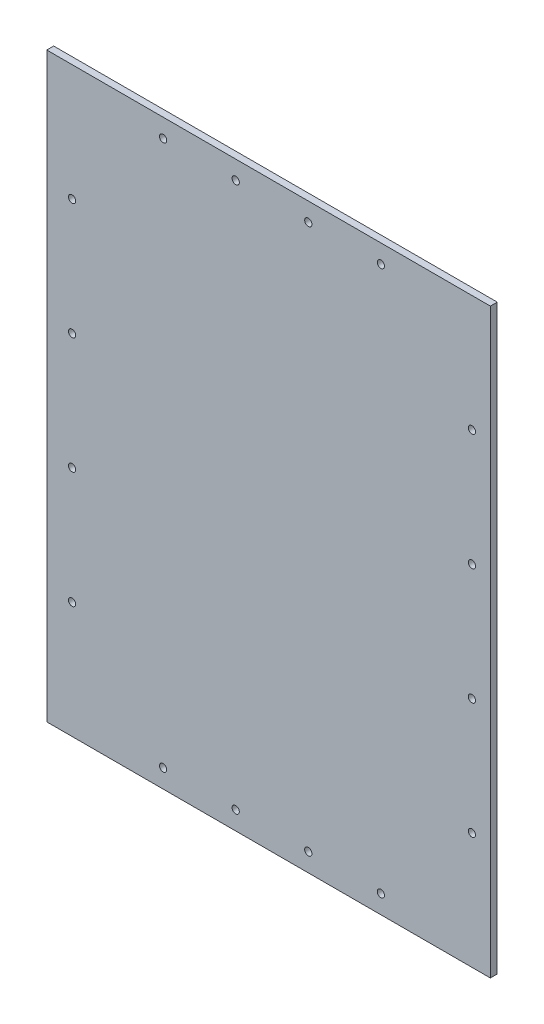
from build123d import *

# Parameters (mm, degrees)
SKETCH_1_W                     = 305.55
SKETCH_1_H                     = 405.55
EXTRUDE_1_DEPTH                = 4.75
SKETCH_3_R                     = 2.5
CUT_EXTRUDE_1_DEPTH            = 10
SKETCH_5_R                     = 2.5
CUT_EXTRUDE_3_DEPTH            = 10
SKETCH_6_R                     = 2.5
CUT_EXTRUDE_4_DEPTH            = 10
SKETCH_7_R                     = 2.5
CUT_EXTRUDE_5_DEPTH            = 10
SPLIT_BODIES_1_SURFACE_1_BACK  = 508.793
SPLIT_BODIES_1_SURFACE_1_DEPTH = 1017.586


with BuildPart() as part:
    # 草圖1 → 填料-伸長1 (new body)
    with BuildSketch(Plane.XY):
        Rectangle(SKETCH_1_W, SKETCH_1_H)
    extrude(amount=EXTRUDE_1_DEPTH)

    # 草圖3 → 除料-伸長1 (cut)
    with BuildSketch(Plane.XY.offset(4.75)):
        with Locations((140.075, 37.705)):
            Circle(SKETCH_3_R)
        with Locations((140.075, 117.865)):
            Circle(SKETCH_3_R)
        with Locations((140.075, -42.455)):
            Circle(SKETCH_3_R)
        with Locations((140.075, -122.615)):
            Circle(SKETCH_3_R)
    extrude(amount=-CUT_EXTRUDE_1_DEPTH, mode=Mode.SUBTRACT)

    # 草圖5 → 除料-伸長3 (cut)
    with BuildSketch(Plane.XY.offset(4.75)):
        with Locations((-135.325, -122.615)):
            Circle(SKETCH_5_R)
        with Locations((-135.325, -42.455)):
            Circle(SKETCH_5_R)
        with Locations((-135.325, 37.705)):
            Circle(SKETCH_5_R)
        with Locations((-135.325, 117.865)):
            Circle(SKETCH_5_R)
    extrude(amount=-CUT_EXTRUDE_3_DEPTH, mode=Mode.SUBTRACT)

    # 草圖6 → 除料-伸長4 (cut)
    with BuildSketch(Plane(origin=(0, 0, 0), x_dir=(-1, 0, 0), z_dir=(0, 0, -1))):
        with Locations((22.625, 185.325)):
            Circle(SKETCH_6_R)
        with Locations((72.625, 185.325)):
            Circle(SKETCH_6_R)
        with Locations((-77.375, 185.325)):
            Circle(SKETCH_6_R)
        with Locations((-27.375, 185.325)):
            Circle(SKETCH_6_R)
    extrude(amount=-CUT_EXTRUDE_4_DEPTH, mode=Mode.SUBTRACT)

    # 草圖7 → 除料-伸長5 (cut)
    with BuildSketch(Plane(origin=(0, 0, 0), x_dir=(-1, 0, 0), z_dir=(0, 0, -1))):
        with Locations((-77.375, -190.075)):
            Circle(SKETCH_7_R)
        with Locations((-27.375, -190.075)):
            Circle(SKETCH_7_R)
        with Locations((22.625, -190.075)):
            Circle(SKETCH_7_R)
        with Locations((72.625, -190.075)):
            Circle(SKETCH_7_R)
    extrude(amount=-CUT_EXTRUDE_5_DEPTH, mode=Mode.SUBTRACT)

    # Split Bodies 1: cut with a surface, the side it looks to stays
    # Split Bodies 1 surface: a surface, the sketch's curves swept straight by 1017.586 mm
    with BuildLine(Plane.XY.offset(4.75).offset(-SPLIT_BODIES_1_SURFACE_1_BACK), mode=Mode.PRIVATE) as split_bodies_1_surface_1_path:
        Line((-152.775, 202.775), (152.775, 202.775))
        Line((152.775, 202.775), (152.775, 198.025))
        Line((152.775, 198.025), (-152.775, 198.025))
        Line((-152.775, 198.025), (-152.775, 202.775))
    split_bodies_1_surface_1 = Shell.extrude(split_bodies_1_surface_1_path.wire(), (0 * SPLIT_BODIES_1_SURFACE_1_DEPTH, 0 * SPLIT_BODIES_1_SURFACE_1_DEPTH, 1 * SPLIT_BODIES_1_SURFACE_1_DEPTH))
    split(bisect_by=split_bodies_1_surface_1, keep=Keep.TOP)


solid = part.part
